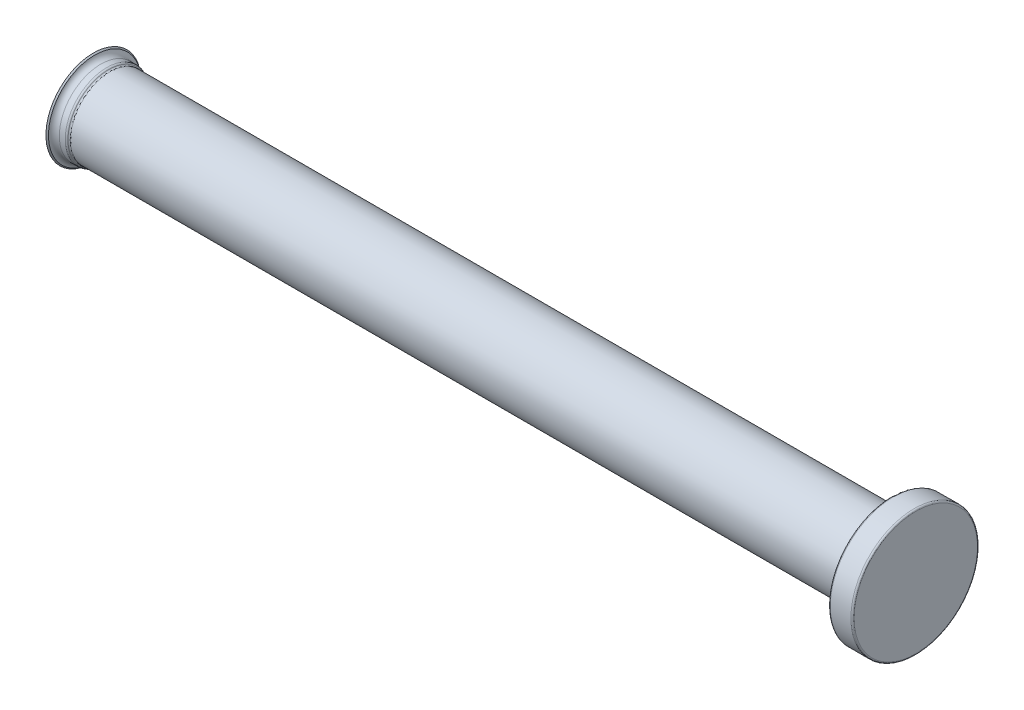
from build123d import *

# Parameters (mm, degrees)
RADYUS1_R = 0.1


with BuildPart() as part:
    # Çizim1 → Döndür1 (revolve)
    with BuildSketch(Plane.XY):
        Polygon((0, 0), (-51, 0), (-51, 2.5), (-1.5, 2.5), (-1.5, 4), (0, 4), align=None)
    revolve(axis=Axis((0, 0, 0), (1, 0, 0)))

    # Radyus1
    radyus1_edges = [part.edges().sort_by_distance(p)[0] for p in [
        (0, -4, 0),
        (-1.5, -4, 0),
    ]]
    fillet(radyus1_edges, radius=RADYUS1_R)

    # Kes-Ekstrüzyon1 cone 1 section (through the dimple's axis) → Kes-Ekstrüzyon1 (revolve, cut)
    with BuildSketch(Plane(origin=(-51, 0, 0), x_dir=(0, 0, 1), z_dir=(0, 1, 0))):
        Polygon((0, 0), (2.5, 0), (0, 0.440817452), align=None)
    revolve(axis=Axis((-51, 0, 0), (1, 0, 0)), mode=Mode.SUBTRACT)


with BuildPart() as body_2:
    # Çizim4 → Döndür2 (revolve)
    with BuildSketch(Plane.XY):
        with BuildLine():
            Line((-51.5, 2.5), (-51.122086007, 2.5))
            ThreePointArc((-51.122086007, 2.5), (-51.044002307, 2.472672569), (-51, 2.402617949))
            Line((-51, 2.402617949), (-50.908332988, 2.000595733))
            Line((-50.908332988, 2.000595733), (-50.908332988, 2.5))
            ThreePointArc((-50.908332988, 2.5), (-50.970942722, 2.516776227), (-51.016776227, 2.562609733))
            ThreePointArc((-51.016776227, 2.562609733), (-51.062609733, 2.608443239), (-51.125219467, 2.625219467))
            Line((-51.125219467, 2.625219467), (-51.5, 2.625219467))
            ThreePointArc((-51.5, 2.625219467), (-51.744473143, 2.708623695), (-51.886995816, 2.924055054))
            Line((-51.886995816, 2.924055054), (-51.971562154, 3))
            Line((-51.971562154, 3), (-52.00814434, 2.89238567))
            ThreePointArc((-52.00814434, 2.89238567), (-51.821005134, 2.609513811), (-51.5, 2.5))
        make_face()
    revolve(axis=Axis((-51, 0, 0), (-1, 0, 0)))


solid = Compound([part.part, body_2.part])
